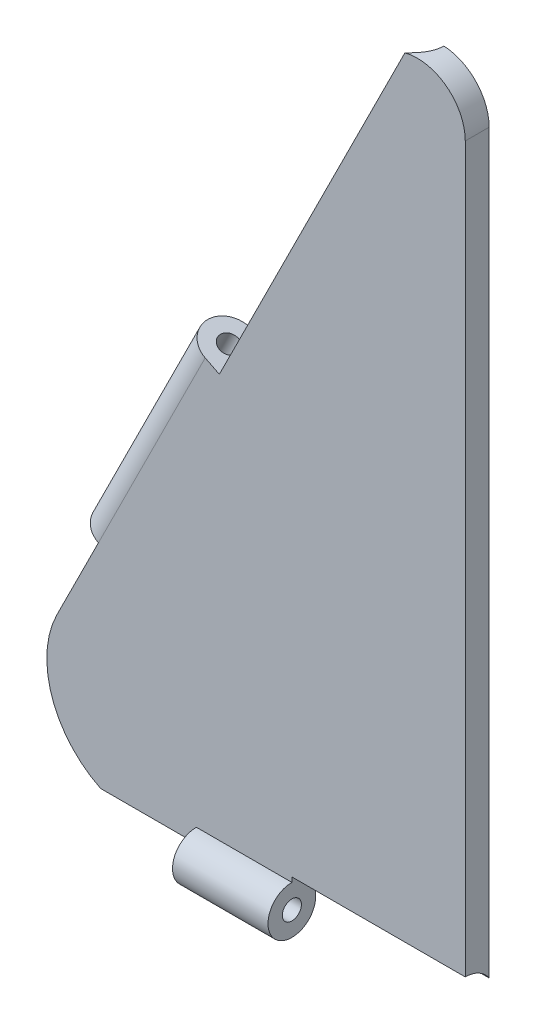
from build123d import *

# Parameters (mm, degrees)
EXTRUDE_1_DEPTH          = 5
SKETCH_3_W               = 5
SKETCH_3_H               = 50
CUT_EXTRUDE_1_DEPTH      = 692.252839152
CUT_EXTRUDE_1_DEPTH_BACK = 692.252839152
SKETCH_5_R               = 2
SKETCH_7_R               = 6
CUT_EXTRUDE_2_DEPTH      = 692.25283929
SKETCH_2_W               = 20
SKETCH_2_H               = 5
SKETCH_8_R               = 6
CUT_EXTRUDE_3_DEPTH      = 346.118964709
CUT_EXTRUDE_4_DEPTH      = 346.897812083
CUT_EXTRUDE_4_DEPTH_BACK = 346.897812083
SKETCH_9_R               = 2
SCALE_1_SCALE            = 0.5


with BuildPart() as part:
    # 草图1 → 凸台-拉伸1 (new body)
    with BuildSketch(Plane.XY.offset(5)):
        with BuildLine():
            Line((-531.259329651, 335.424320593), (-597.842921786, 202.257136323))
            ThreePointArc((-597.842921786, 202.257136323), (-596.967394134, 182.798242171), (-579.954377966, 173.312864413))
            Line((-579.954377966, 173.312864413), (-512.315057741, 173.312864413))
            Line((-512.315057741, 173.312864413), (-512.315057741, 330.952184638))
            ThreePointArc((-512.315057741, 330.952184638), (-520.017528536, 340.684674533), (-531.259329651, 335.424320593))
        make_face()
    extrude(amount=EXTRUDE_1_DEPTH)

    # 草图3 → 旋转1 (revolve)
    with BuildSketch(Plane(origin=(-559.177191958, 279.588595979, 0), x_dir=(0, 0, 1), z_dir=(-0.894427190999916, 0.4472135954999579, 0))):
        with Locations((7.5, -42.016481195)):
            Rectangle(SKETCH_3_W, SKETCH_3_H)
    revolve(axis=Axis((-566.787193696, 264.368592503, 5), (-0.447213595499958, -0.894427190999916, 0)))

    # 草图5 → 切除-拉伸1 (cut, two sides: drawn at the far end of the back side and taken through both)
    with BuildSketch(Plane(origin=(-7.610001738, -15.220003476, 0), x_dir=(0.894427190999916, -0.4472135954999579, 0), z_dir=(0.4472135954999579, 0.894427190999916, 0)).offset(-CUT_EXTRUDE_1_DEPTH_BACK)):
        with Locations(Location((-625.179106343, -5, 0), (0, 0, 270))):
            Circle(SKETCH_5_R)
    extrude(amount=CUT_EXTRUDE_1_DEPTH + CUT_EXTRUDE_1_DEPTH_BACK, mode=Mode.SUBTRACT)

    # 草图7 → 切除-拉伸2 (cut, through all)
    with BuildSketch(Plane(origin=(-7.610001738, -15.220003476, 0), x_dir=(0.894427190999916, -0.4472135954999579, 0), z_dir=(0.4472135954999579, 0.894427190999916, 0))):
        with Locations((-625.179106343, -5)):
            Circle(SKETCH_7_R)
    extrude(amount=CUT_EXTRUDE_2_DEPTH, mode=Mode.SUBTRACT)

    # 草图2 → 旋转2 (revolve)
    with BuildSketch(Plane.XZ.offset(-173.312864413)):
        with Locations((-558.634717854, 7.5)):
            Rectangle(SKETCH_2_W, SKETCH_2_H)
    revolve(axis=Axis((-548.634717854, 173.312864413, 10), (-1, 0, 0)))

    # 草图8 → 切除-拉伸3 (cut, through all)
    with BuildSketch(Plane(origin=(-548.634717854, 0, 0), x_dir=(0, 0, -1), z_dir=(1, 0, 0))):
        with Locations((-10, 173.312864413)):
            Circle(SKETCH_8_R)
    extrude(amount=CUT_EXTRUDE_3_DEPTH, mode=Mode.SUBTRACT)

    # 草图9 → 切除-拉伸4 (cut, two sides: drawn at the far end of the back side and taken through both)
    with BuildSketch(Plane.ZY.offset(568.634717854).offset(-CUT_EXTRUDE_4_DEPTH_BACK)):
        with Locations((10, 173.312864413)):
            Circle(SKETCH_9_R)
    extrude(amount=CUT_EXTRUDE_4_DEPTH + CUT_EXTRUDE_4_DEPTH_BACK, mode=Mode.SUBTRACT)


with BuildPart() as part_1:
    # 缩放比例1: scaled about (0, 0, 0)
    add(part.part.scale(SCALE_1_SCALE))


solid = part_1.part
